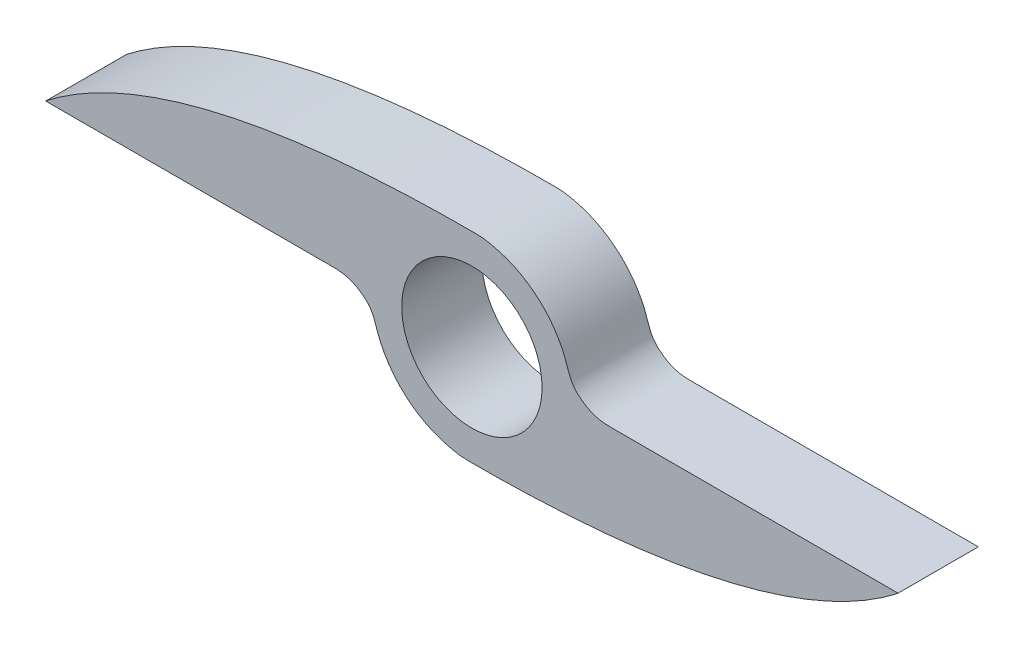
from build123d import *

# Parameters (mm, degrees)
SKETCH1_R           = 7
BOSS_EXTRUDE1_DEPTH = 8


with BuildPart() as part:
    # Sketch1 → Boss-Extrude1 (new body)
    with BuildSketch(Plane.XY):
        with BuildLine():
            add(Edge.make_bspline(
                [(14.142135624, 0), (23.557125346, 0), (32.972115068, 0), (42.38710479, 0), (42.395312266, 0), (42.41172722, 0), (42.46872118, -0.024602343), (42.45580037, -0.034726738), (42.449339965, -0.039788935), (42.443705988, -0.044203566), (42.432438033, -0.053032828), (42.415517813, -0.066253386), (42.404233254, -0.075061418), (42.398589317, -0.079463309), (34.390017957, -6.325609683), (21.339264297, -9.622242406), (3.246328335, -9.969361478), (2.868000027, -9.976619834), (2.111292323, -9.988473644), (0.976070459, -9.998265044), (0.219270867, -9.999465384), (-0.159126355, -9.99873386), (-0.482228104, -9.998109234), (-1.128427849, -9.994918126), (-2.0957983, -9.793967313), (-2.721131262, -9.628075601), (-3.029054465, -9.530206139), (-6.071086105, -8.563335183), (-8.364093969, -6.342769743), (-9.428090416, -3.333333333), (-9.641923849, -2.728521051), (-9.953194537, -1.477744223), (-12.217634726, 0), (-13.500635325, 0), (-14.142135624, 0), (-23.557125346, 0), (-32.972115068, 0), (-42.38710479, 0), (-42.395312266, 0), (-42.41172722, 0), (-42.46872118, 0.024602343), (-42.45580037, 0.034726738), (-42.449339965, 0.039788935), (-42.443705988, 0.044203566), (-42.432438033, 0.053032828), (-42.415517813, 0.066253386), (-42.404233254, 0.075061418), (-42.398589317, 0.079463309), (-34.390017957, 6.325609683), (-21.339264297, 9.622242406), (-3.246328335, 9.969361478), (-2.868000027, 9.976619834), (-2.111292323, 9.988473644), (-0.976070459, 9.998265044), (-0.219270867, 9.999465384), (0.159126355, 9.99873386), (0.482228104, 9.998109234), (1.128427849, 9.994918126), (2.0957983, 9.793967313), (2.721131262, 9.628075601), (3.029054465, 9.530206139), (6.071086105, 8.563335183), (8.364093969, 6.342769743), (9.428090416, 3.333333333), (9.641923849, 2.728521051), (9.953194537, 1.477744223), (12.217634726, 0), (13.500635325, 0), (14.142135624, 0)],
                knots=[0, 0, 0, 0, 0.256122997, 0.256122997, 0.256122997, 0.256346271, 0.256569545, 0.256792819, 0.256792819, 0.256792819, 0.256987531, 0.257182244, 0.257376956, 0.257376956, 0.257376956, 0.533667884, 0.533667884, 0.533667884, 0.539445203, 0.545222523, 0.550999843, 0.550999843, 0.550999843, 0.555932919, 0.560865995, 0.565799071, 0.565799071, 0.565799071, 0.611133364, 0.611133364, 0.611133364, 0.620927689, 0.630722015, 0.64051634, 0.64051634, 0.64051634, 0.784262918, 0.784262918, 0.784262918, 0.784388229, 0.784513539, 0.78463885, 0.78463885, 0.78463885, 0.78474813, 0.784857411, 0.784966691, 0.784966691, 0.784966691, 0.940032327, 0.940032327, 0.940032327, 0.943274793, 0.946517258, 0.949759724, 0.949759724, 0.949759724, 0.952528365, 0.955297007, 0.958065648, 0.958065648, 0.958065648, 0.983509086, 0.983509086, 0.983509086, 0.989006057, 0.994503029, 1, 1, 1, 1], degree=3, weights=[1, 1, 1, 1, 1, 1, 1, 1, 1, 1, 1, 1, 1, 1, 1, 1, 1, 1, 1, 1, 1, 1, 1, 1, 1, 1, 1, 0.930224452, 0.930224452, 1, 1, 1, 1, 1, 1, 1, 1, 1, 1, 1, 1, 1, 1, 1, 1, 1, 1, 1, 1, 1, 1, 1, 1, 1, 1, 1, 1, 1, 1, 1, 1, 0.930224452, 0.930224452, 1, 1, 1, 1, 1, 1]))
        make_face()
        Circle(SKETCH1_R, mode=Mode.SUBTRACT)
    extrude(amount=BOSS_EXTRUDE1_DEPTH)


solid = part.part
